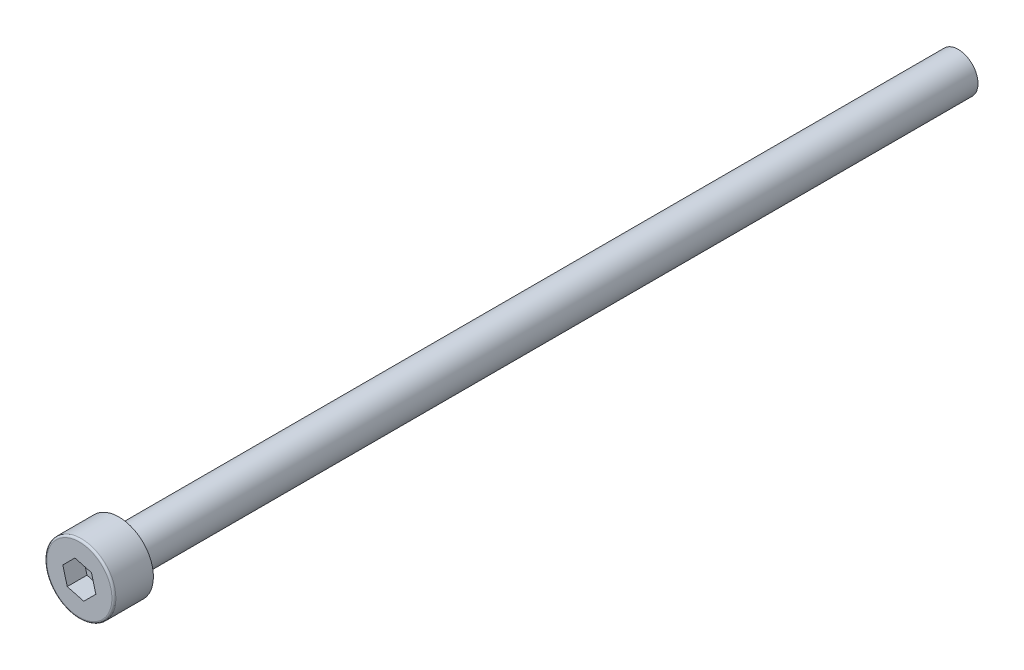
from build123d import *

# Parameters (mm, degrees)
SKETCH_1_R          = 3.5
EXTRUDE_1_DEPTH     = 4
CUT_EXTRUDE_1_DEPTH = 2
SKETCH_3_R          = 2
EXTRUDE_2_DEPTH     = 85
FILLET_1_R          = 0.2


with BuildPart() as part:
    # 草图1 → 凸台-拉伸1 (new body)
    with BuildSketch(Plane.XY):
        Circle(SKETCH_1_R)
    extrude(amount=EXTRUDE_1_DEPTH)

    # 草图2 → 切除-拉伸1 (cut)
    with BuildSketch(Plane.XY.offset(4)):
        Polygon((-1.224744871, -1.224744871), (0.448287736, -1.673032607), (1.673032607, -0.448287736), (1.224744871, 1.224744871), (-0.448287736, 1.673032607), (-1.673032607, 0.448287736), align=None)
    extrude(amount=-CUT_EXTRUDE_1_DEPTH, mode=Mode.SUBTRACT)

    # 草图3 → 凸台-拉伸2 (add)
    with BuildSketch(Plane(origin=(0, 0, 0), x_dir=(-1, 0, 0), z_dir=(0, 0, -1))):
        with Locations(Location((0, 0, 0), (0, 0, 180))):
            Circle(SKETCH_3_R)
    extrude(amount=EXTRUDE_2_DEPTH)

    # 圆角1
    fillet_1_edges = [part.edges().sort_by_distance(p)[0] for p in [
        (-3.5, 0, 4),
    ]]
    fillet(fillet_1_edges, radius=FILLET_1_R)


solid = part.part
